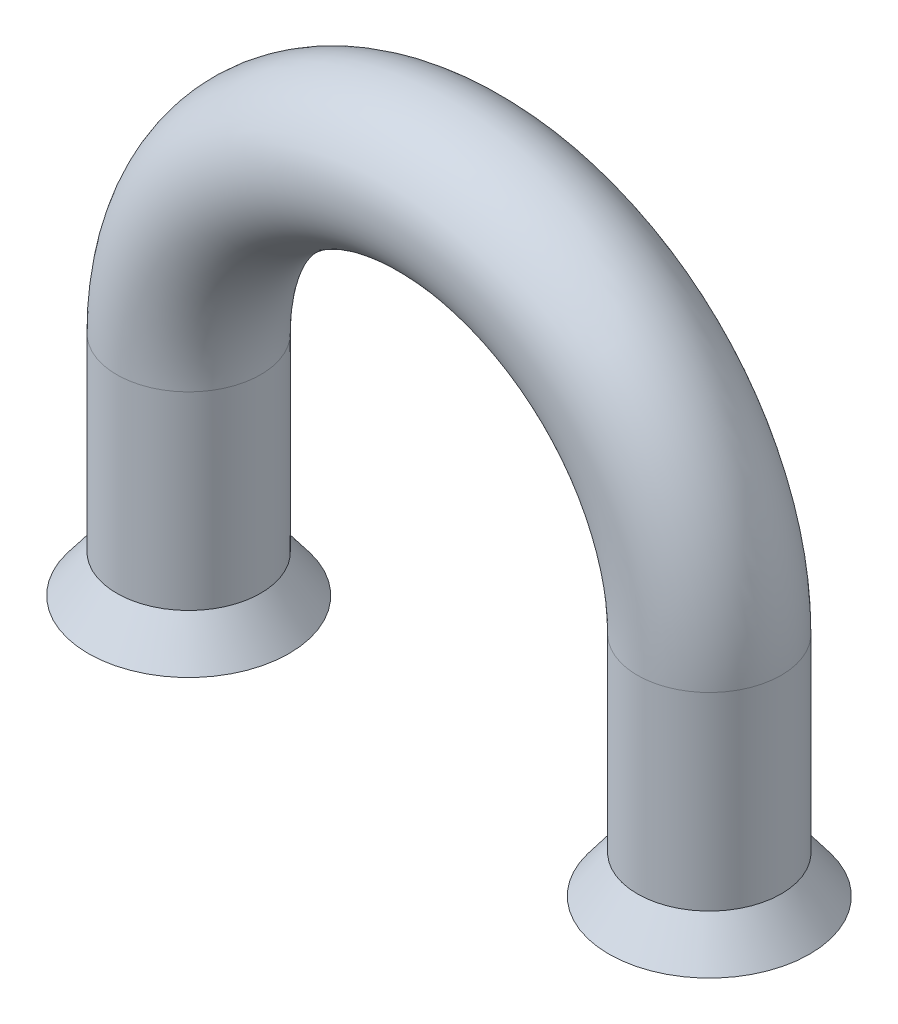
from build123d import *

# Parameters (mm, degrees)
SKETCH1_R           = 4.826
SKETCH1_R_2         = 4.064
SKETCH3_R           = 4.826
BOSS_EXTRUDE1_DEPTH = 2.54
BOSS_EXTRUDE1_DRAFT = -37
SKETCH5_R           = 4.826
BOSS_EXTRUDE2_DEPTH = 2.54
BOSS_EXTRUDE2_DRAFT = -37


with BuildPart() as part:
    # Sweep1: sweep along a path in Sketch2
    with BuildLine(Plane.XY) as sweep1_path:
        Line((0, 0), (0, 12.7))
        ThreePointArc((0, 12.7), (17.4625, 30.1625), (34.925, 12.7))
        Line((34.925, 12.7), (34.925, 0))
    # Sketch1 → Sweep1 (sweep)
    with BuildSketch(Plane(origin=(0, 0, 0), x_dir=(1, 0, 0), z_dir=(0, 1, 0))):
        Circle(SKETCH1_R)
        Circle(SKETCH1_R_2, mode=Mode.SUBTRACT)
    sweep(path=sweep1_path.line)


with BuildPart() as boss_extrude1_tool:
    # Sketch3 → Boss-Extrude1 (with draft: the straight prism first)
    with BuildSketch(Plane.XZ):
        with Locations(Location((0, 0, 0), (0, 0, 180))):
            Circle(SKETCH3_R)
    extrude(amount=BOSS_EXTRUDE1_DEPTH)
    # Boss-Extrude1: the draft: its side faces are tilted about the plane it starts from
    boss_extrude1_sides = [boss_extrude1_tool.faces().sort_by_distance(p)[0] for p in [
        (4.826, -1.27, 0),
    ]]
    draft(boss_extrude1_sides, Plane.XZ, BOSS_EXTRUDE1_DRAFT)


with BuildPart() as part_1:
    add(part.part)

    # Boss-Extrude1: add boss_extrude1_tool
    add(boss_extrude1_tool.part)

    # Cut-Extrude1 cone 1 section (through the dimple's axis) → Cut-Extrude1 (revolve, cut)
    with BuildSketch(Plane(origin=(0, -2.54, 0), x_dir=(0, 0, -1), z_dir=(1, 0, 0))):
        Polygon((0, 0), (5.978027287, 0), (0, 7.933110155), align=None)
    revolve(axis=Axis((0, -2.54, 0), (0, 1, 0)), mode=Mode.SUBTRACT)


with BuildPart() as boss_extrude2_tool:
    # Sketch5 → Boss-Extrude2 (with draft: the straight prism first)
    with BuildSketch(Plane(origin=(0, 0, 0), x_dir=(0, 0, -1), z_dir=(0, -1, 0))):
        with Locations(Location((0, 34.925, 0), (0, 0, 90))):
            Circle(SKETCH5_R)
    extrude(amount=BOSS_EXTRUDE2_DEPTH)
    # Boss-Extrude2: the draft: its side faces are tilted about the plane it starts from
    boss_extrude2_sides = [boss_extrude2_tool.faces().sort_by_distance(p)[0] for p in [
        (30.099, -1.27, 0),
    ]]
    draft(boss_extrude2_sides, Plane(origin=(0, 0, 0), x_dir=(0, 0, -1), z_dir=(0, -1, 0)), BOSS_EXTRUDE2_DRAFT)


with BuildPart() as part_2:
    add(part_1.part)

    # Boss-Extrude2: add boss_extrude2_tool
    add(boss_extrude2_tool.part)

    # Cut-Extrude2 cone 1 section (through the dimple's axis) → Cut-Extrude2 (revolve, cut)
    with BuildSketch(Plane(origin=(34.925, -2.54, 0), x_dir=(0, 0, -1), z_dir=(1, 0, 0))):
        Polygon((0, 0), (5.978027287, 0), (0, 7.933110155), align=None)
    revolve(axis=Axis((34.925, -2.54, 0), (0, 1, 0)), mode=Mode.SUBTRACT)


solid = part_2.part
